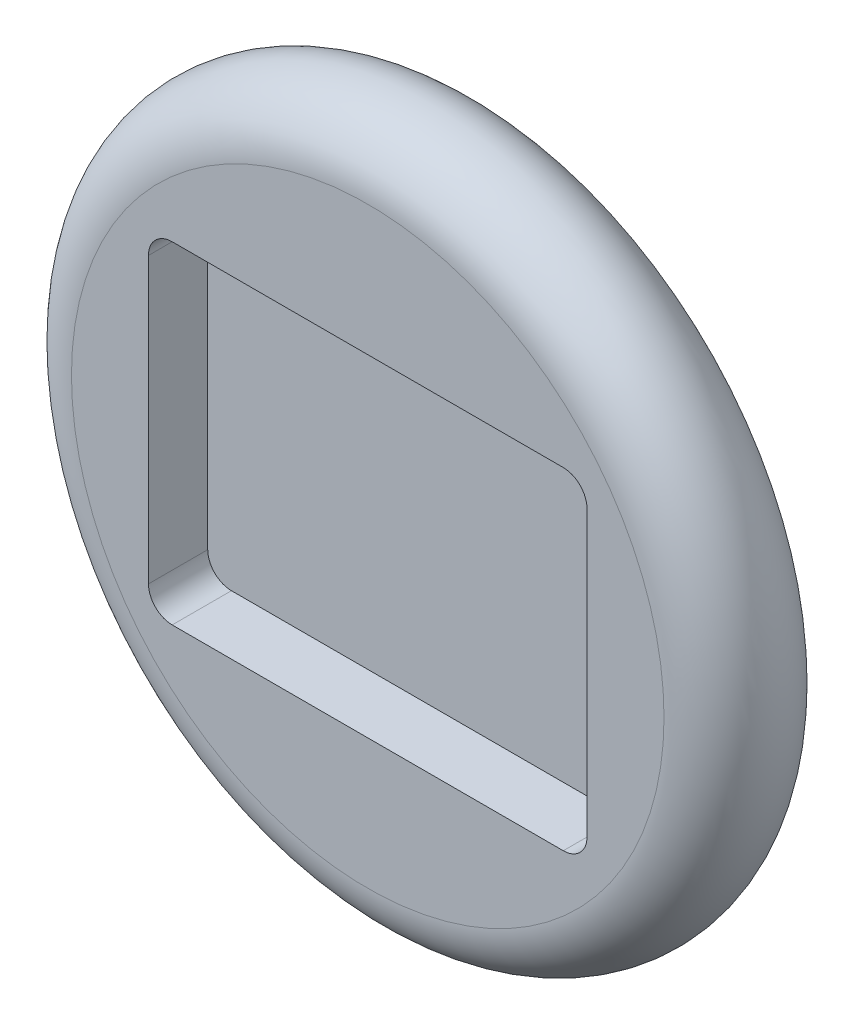
from build123d import *

# Parameters (mm, degrees)
CUT_EXTRUDE3_DEPTH = 5


with BuildPart() as part:
    # Sketch7 → Revolve2 (revolve)
    with BuildSketch(Plane(origin=(0, 0, 0), x_dir=(1, 0, 0), z_dir=(0, 1, 0))):
        with BuildLine():
            Line((0, -2.5), (0, 7.5))
            Line((0, 7.5), (25, 7.5))
            ThreePointArc((25, 7.5), (30, 2.5), (25, -2.5))
            Line((25, -2.5), (0, -2.5))
        make_face()
    revolve(axis=Axis((0, 0, 2.5), (0, 0, -1)))

    # Sketch9 → Cut-Extrude3 (cut)
    with BuildSketch(Plane.XY.offset(2.5)):
        with BuildLine():
            Line((16.5, -14), (-16.5, -14))
            ThreePointArc((-16.5, -14), (-17.914213562, -13.414213562), (-18.5, -12))
            Line((-18.5, -12), (-18.5, 12))
            ThreePointArc((-18.5, 12), (-17.914213562, 13.414213562), (-16.5, 14))
            Line((-16.5, 14), (16.5, 14))
            ThreePointArc((16.5, 14), (17.914213562, 13.414213562), (18.5, 12))
            Line((18.5, 12), (18.5, -12))
            ThreePointArc((18.5, -12), (17.914213562, -13.414213562), (16.5, -14))
        make_face()
    extrude(amount=-CUT_EXTRUDE3_DEPTH, mode=Mode.SUBTRACT)


solid = part.part
